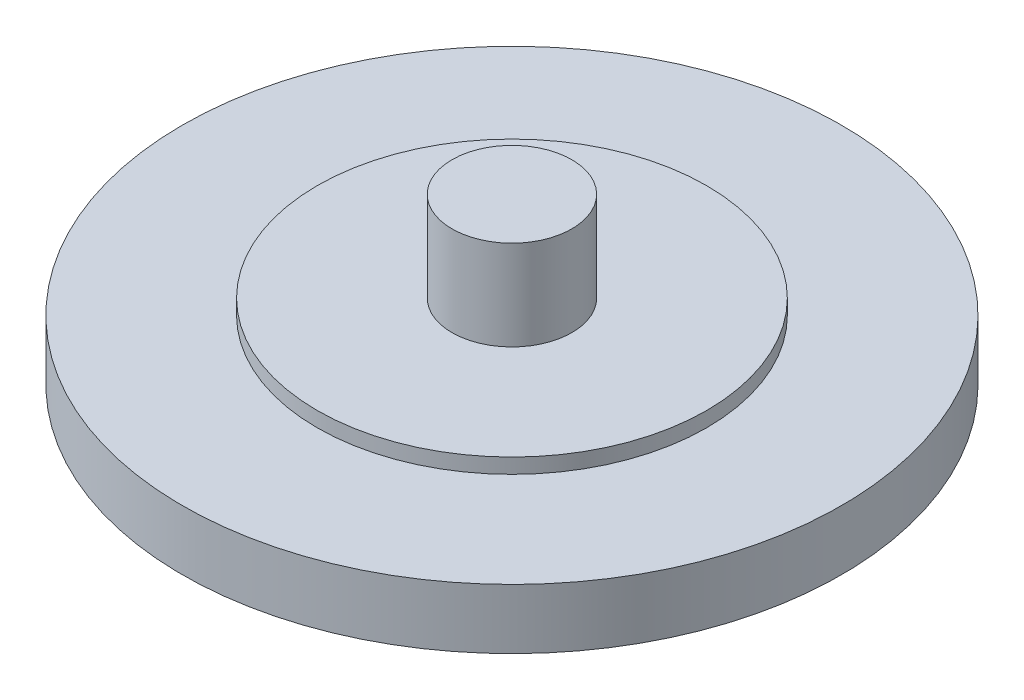
from build123d import *


with BuildPart() as part:
    # Sketch1 → Revolve1 (revolve)
    with BuildSketch(Plane.XY, mode=Mode.PRIVATE) as revolve1_sk:
        Polygon((0, 0), (11, 0), (11, 2), (6.5, 2), (6.5, 2.5), (2, 2.5), (2, 5.5), (0, 5.5), align=None)
    revolve(revolve1_sk.sketch.rotate(Axis((0, 5.5, 0), (0, -1, 0)), 180), axis=Axis((0, 5.5, 0), (0, -1, 0)))


solid = part.part
